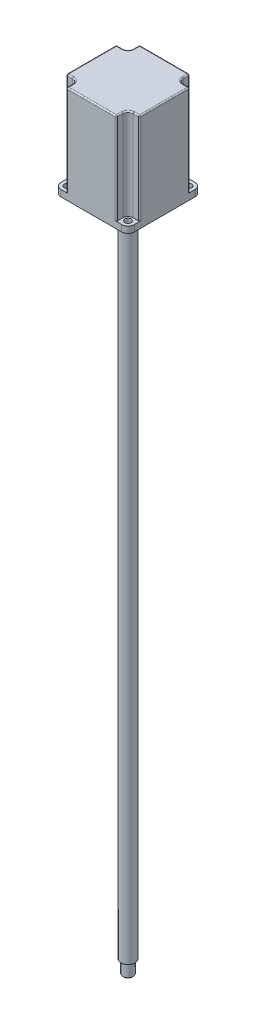
from build123d import *

# Parameters (mm, degrees)
SKETCH1_W                = 57
SKETCH1_H                = 57
EXTRUDE1_DEPTH           = 76
F_5_0_5_DIAMETER_HOLE1_D = 5
SKETCH6_R                = 4
SKETCH6_R_2              = 2.5
EXTRUDE4_DEPTH           = 71
FILLET1_R                = 5
SKETCH7_R                = 3
EXTRUDE5_DEPTH           = 101
SKETCH8_R                = 19.05
EXTRUDE6_DEPTH           = 3
FILLET2_R                = 1
SKETCH9_R                = 5.5
BOSS_EXTRUDE1_DEPTH      = 516
CHAMFER1_SIZE            = 0.5
SKETCH10_R               = 4
BOSS_EXTRUDE2_DEPTH      = 10
CHAMFER2_SIZE            = 0.5


with BuildPart() as part:
    # Sketch1 → Extrude1 (new body)
    with BuildSketch(Plane(origin=(0, 0, 0), x_dir=(1, 0, 0), z_dir=(0, 1, 0))):
        Rectangle(SKETCH1_W, SKETCH1_H)
    extrude(amount=EXTRUDE1_DEPTH)

    # Ø5.0 (5) Diameter Hole1 (through all)
    with Locations(Plane.XZ):
        with Locations((-23.5, 23.5), (23.5, 23.5), (23.5, -23.5), (-23.5, -23.5)):
            Hole(F_5_0_5_DIAMETER_HOLE1_D / 2)

    # Sketch6 → Extrude4 (cut)
    # profile 1 of 12: a face of its own
    with BuildSketch(Plane(origin=(0, 76, 0), x_dir=(1, 0, 0), z_dir=(0, 1, 0))):
        Polygon((-28.5, 28.5), (-19.5, 28.5), (-19.5, 32.511741208), (-33.908905561, 32.511741208), (-33.908905561, 19.5), (-28.5, 19.5), align=None)
    # profile 2 of 12: a face of its own
    with BuildSketch(Plane(origin=(0, 76, 0), x_dir=(1, 0, 0), z_dir=(0, 1, 0))):
        with BuildLine():
            ThreePointArc((-23.5, 19.5), (-26.328427125, 26.328427125), (-19.5, 23.5))
            Line((-19.5, 23.5), (-19.5, 28.5))
            Line((-19.5, 28.5), (-28.5, 28.5))
            Line((-28.5, 28.5), (-28.5, 19.5))
            Line((-28.5, 19.5), (-23.5, 19.5))
        make_face()
    # profile 3 of 12: a face of its own
    with BuildSketch(Plane(origin=(0, 76, 0), x_dir=(1, 0, 0), z_dir=(0, 1, 0))):
        with Locations((-23.5, 23.5)):
            Circle(SKETCH6_R)
        with Locations(Location((-23.5, 23.5, 0), (0, 0, 90))):
            Circle(SKETCH6_R_2, mode=Mode.SUBTRACT)
    # profile 4 of 12: a face of its own
    with BuildSketch(Plane(origin=(0, 76, 0), x_dir=(1, 0, 0), z_dir=(0, 1, 0))):
        Polygon((19.5, 36.471560472), (19.5, 28.5), (28.5, 28.5), (28.5, 19.5), (41.168352552, 19.5), (41.168352552, 36.471560472), align=None)
    # profile 5 of 12: a face of its own
    with BuildSketch(Plane(origin=(0, 76, 0), x_dir=(1, 0, 0), z_dir=(0, 1, 0))):
        with BuildLine():
            Line((28.5, 28.5), (19.5, 28.5))
            Line((19.5, 28.5), (19.5, 23.5))
            ThreePointArc((19.5, 23.5), (23.5, 27.5), (27.5, 23.5))
            ThreePointArc((27.5, 23.5), (26.328427125, 20.671572875), (23.5, 19.5))
            Line((23.5, 19.5), (28.5, 19.5))
            Line((28.5, 19.5), (28.5, 28.5))
        make_face()
    # profile 6 of 12: a face of its own
    with BuildSketch(Plane(origin=(0, 76, 0), x_dir=(1, 0, 0), z_dir=(0, 1, 0))):
        with Locations((23.5, 23.5)):
            Circle(SKETCH6_R)
        with Locations(Location((23.5, 23.5, 0), (0, 0, 90))):
            Circle(SKETCH6_R_2, mode=Mode.SUBTRACT)
    # profile 7 of 12: a face of its own
    with BuildSketch(Plane(origin=(0, 76, 0), x_dir=(1, 0, 0), z_dir=(0, 1, 0))):
        with Locations((23.5, -23.5)):
            Circle(SKETCH6_R)
        with Locations(Location((23.5, -23.5, 0), (0, 0, 90))):
            Circle(SKETCH6_R_2, mode=Mode.SUBTRACT)
    # profile 8 of 12: a face of its own
    with BuildSketch(Plane(origin=(0, 76, 0), x_dir=(1, 0, 0), z_dir=(0, 1, 0))):
        with BuildLine():
            Line((28.5, -28.5), (28.5, -19.5))
            Line((28.5, -19.5), (23.5, -19.5))
            ThreePointArc((23.5, -19.5), (26.328427125, -20.671572875), (27.5, -23.5))
            ThreePointArc((27.5, -23.5), (23.5, -27.5), (19.5, -23.5))
            Line((19.5, -23.5), (19.5, -28.5))
            Line((19.5, -28.5), (28.5, -28.5))
        make_face()
    # profile 9 of 12: a face of its own
    with BuildSketch(Plane(origin=(0, 76, 0), x_dir=(1, 0, 0), z_dir=(0, 1, 0))):
        Polygon((44.252209519, -19.5), (28.5, -19.5), (28.5, -28.5), (19.5, -28.5), (19.5, -40.050429997), (44.252209519, -40.050429997), align=None)
    # profile 10 of 12: a face of its own
    with BuildSketch(Plane(origin=(0, 76, 0), x_dir=(1, 0, 0), z_dir=(0, 1, 0))):
        Polygon((-28.5, -28.5), (-28.5, -19.5), (-37.670786859, -19.5), (-37.670786859, -37.828231874), (-19.5, -37.828231874), (-19.5, -28.5), align=None)
    # profile 11 of 12: a face of its own
    with BuildSketch(Plane(origin=(0, 76, 0), x_dir=(1, 0, 0), z_dir=(0, 1, 0))):
        with BuildLine():
            Line((-23.5, -19.5), (-28.5, -19.5))
            Line((-28.5, -19.5), (-28.5, -28.5))
            Line((-28.5, -28.5), (-19.5, -28.5))
            Line((-19.5, -28.5), (-19.5, -23.5))
            ThreePointArc((-19.5, -23.5), (-26.328427125, -26.328427125), (-23.5, -19.5))
        make_face()
    # profile 12 of 12: a face of its own
    with BuildSketch(Plane(origin=(0, 76, 0), x_dir=(1, 0, 0), z_dir=(0, 1, 0))):
        with Locations((-23.5, -23.5)):
            Circle(SKETCH6_R)
        with Locations(Location((-23.5, -23.5, 0), (0, 0, 90))):
            Circle(SKETCH6_R_2, mode=Mode.SUBTRACT)
    extrude(amount=-EXTRUDE4_DEPTH, mode=Mode.SUBTRACT)

    # Fillet1
    fillet1_edges = [part.edges().sort_by_distance(p)[0] for p in [
        (-28.5, 2.5, 28.5),
        (-28.5, 2.5, -28.5),
        (28.5, 2.5, -28.5),
        (28.5, 2.5, 28.5),
    ]]
    fillet(fillet1_edges, radius=FILLET1_R)



with BuildPart() as body_2:
    # Sketch7 → Extrude5 (new body)
    with BuildSketch(Plane(origin=(0, 76, 0), x_dir=(1, 0, 0), z_dir=(0, 1, 0))):
        with Locations(Location((0, 0, 0), (0, 0, 270))):
            Circle(SKETCH7_R)
    extrude(amount=-EXTRUDE5_DEPTH)


with BuildPart() as part_1:
    add(part.part)

    add(body_2.part)  # Extrude6 merges body 2
    # Sketch8 → Extrude6 (add)
    with BuildSketch(Plane.XZ):
        with Locations(Location((0, 0, 0), (0, 0, 270))):
            Circle(SKETCH8_R)
    extrude(amount=EXTRUDE6_DEPTH)

    # Fillet2
    fillet2_edges = [part_1.edges().sort_by_distance(p)[0] for p in [
        (-28.5, 40.5, 19.5),
        (0, 76, 28.5),
        (-19.5, 40.5, 28.5),
        (-19.5, 76, 26),
        (-20.671572875, 76, 20.671572875),
        (-26, 76, 19.5),
        (-28.5, 76, 0),
        (-28.5, 40.5, -19.5),
        (-19.5, 40.5, -28.5),
        (-19.5, 76, -26),
        (-26, 76, -19.5),
        (-20.671572875, 76, -20.671572875),
        (0, 76, -28.5),
        (19.5, 76, -26),
        (26, 76, -19.5),
        (20.671572875, 76, -20.671572875),
        (19.5, 40.5, -28.5),
        (28.5, 40.5, -19.5),
        (19.5, 40.5, 28.5),
        (28.5, 76, 0),
        (26, 76, 19.5),
        (19.5, 76, 26),
        (20.671572875, 76, 20.671572875),
        (28.5, 40.5, 19.5),
    ]]
    fillet(fillet2_edges, radius=FILLET2_R)

    # Sketch9 → Boss-Extrude1 (add)
    with BuildSketch(Plane.XZ):
        with Locations(Location((0, 0, 0), (0, 0, 270))):
            Circle(SKETCH9_R)
    extrude(amount=BOSS_EXTRUDE1_DEPTH)

    # Chamfer1
    chamfer1_edges = [part_1.edges().sort_by_distance(p)[0] for p in [
        (0, -516, 5.5),
    ]]
    chamfer(chamfer1_edges, length=CHAMFER1_SIZE)

    # Sketch10 → Boss-Extrude2 (add)
    with BuildSketch(Plane.XZ.offset(516)):
        with Locations(Location((0, 0, 0), (0, 0, 270))):
            Circle(SKETCH10_R)
    extrude(amount=BOSS_EXTRUDE2_DEPTH)

    # Chamfer2
    chamfer2_edges = [part_1.edges().sort_by_distance(p)[0] for p in [
        (0, -526, 4),
    ]]
    chamfer(chamfer2_edges, length=CHAMFER2_SIZE)


solid = part_1.part
